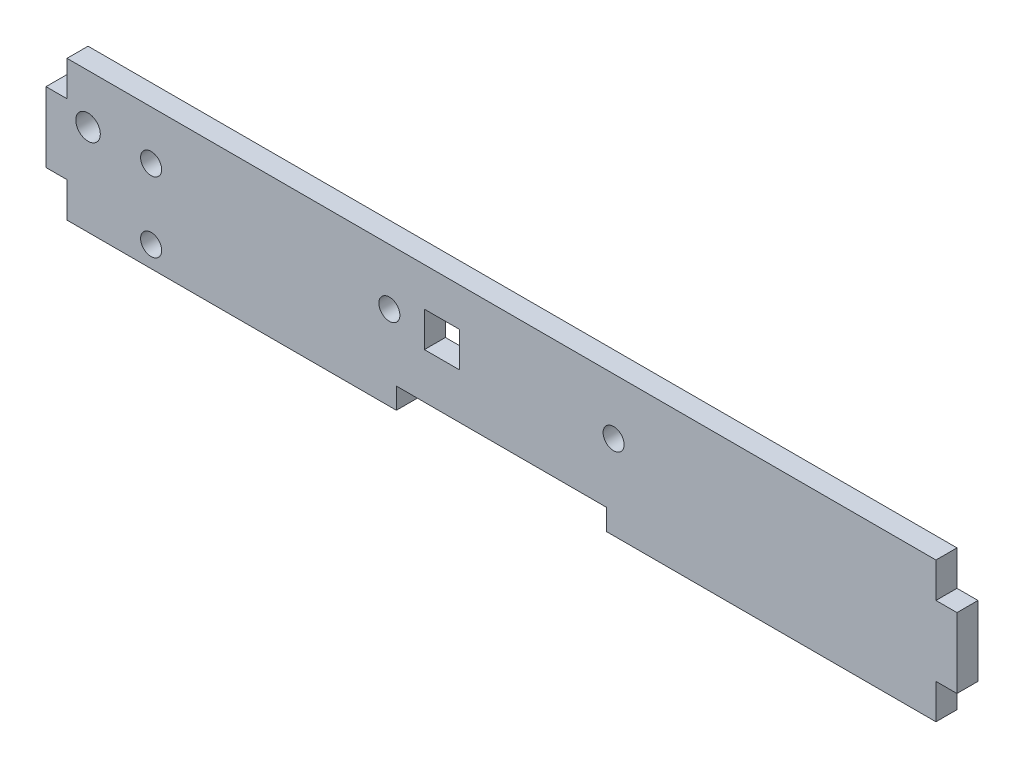
from build123d import *

# Parameters (mm, degrees)
BOSS_EXTRUDE1_DEPTH = 3
SKETCH2_R           = 1.5
SKETCH2_R_2         = 1.75
CUT_EXTRUDE1_DEPTH  = 131.896905999
SKETCH3_R           = 1.5
SKETCH3_W           = 5
SKETCH3_H           = 5
CUT_EXTRUDE2_DEPTH  = 131.896905999


with BuildPart() as part:
    # Sketch1 → Boss-Extrude1 (new body)
    with BuildSketch(Plane.XY):
        Polygon((0, 0), (3, 0), (3, -5), (50, -5), (50, -2), (80, -2), (80, -5), (127, -5), (127, 0), (130, 0), (130, 10), (127, 10), (127, 15), (3, 15), (3, 10), (0, 10), align=None)
    extrude(amount=BOSS_EXTRUDE1_DEPTH)

    # Sketch2 → Cut-Extrude1 (cut, through all)
    with BuildSketch(Plane.XY.offset(3)):
        with Locations((15, 8)):
            Circle(SKETCH2_R)
        with Locations((15, -2)):
            Circle(SKETCH2_R)
        with Locations((6, 8)):
            Circle(SKETCH2_R_2)
    extrude(amount=-CUT_EXTRUDE1_DEPTH, mode=Mode.SUBTRACT)

    # Sketch3 → Cut-Extrude2 (cut, through all)
    with BuildSketch(Plane.XY.offset(3)):
        with Locations((49, 7)):
            Circle(SKETCH3_R)
        with Locations((81, 7)):
            Circle(SKETCH3_R)
        with Locations((56.5, 7)):
            Rectangle(SKETCH3_W, SKETCH3_H)
    extrude(amount=-CUT_EXTRUDE2_DEPTH, mode=Mode.SUBTRACT)


solid = part.part
